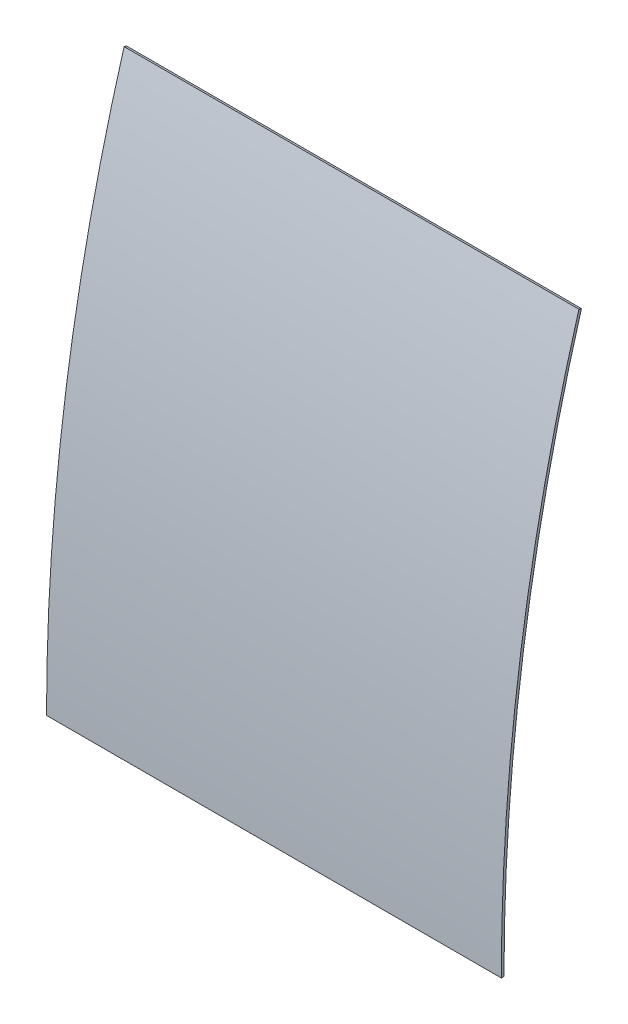
from build123d import *

# Parameters (mm, degrees)
EXTRUDE_THIN1_DEPTH = 269.875


with BuildPart() as part:
    # Sketch1 → Extrude-Thin1 (new body)
    with BuildSketch(Plane(origin=(0, 0, 0), x_dir=(0, 0, -1), z_dir=(1, 0, 0))):
        with BuildLine():
            ThreePointArc((0, 0), (11.568075749, 161.98140868), (46.0375, 320.675))
            Line((46.0375, 320.675), (47.560882459, 320.228388162))
            ThreePointArc((47.560882459, 320.228388162), (13.13946461, 161.755813249), (1.5875, 0))
            Line((1.5875, 0), (0, 0))
        make_face()
    extrude(amount=EXTRUDE_THIN1_DEPTH)


solid = part.part
